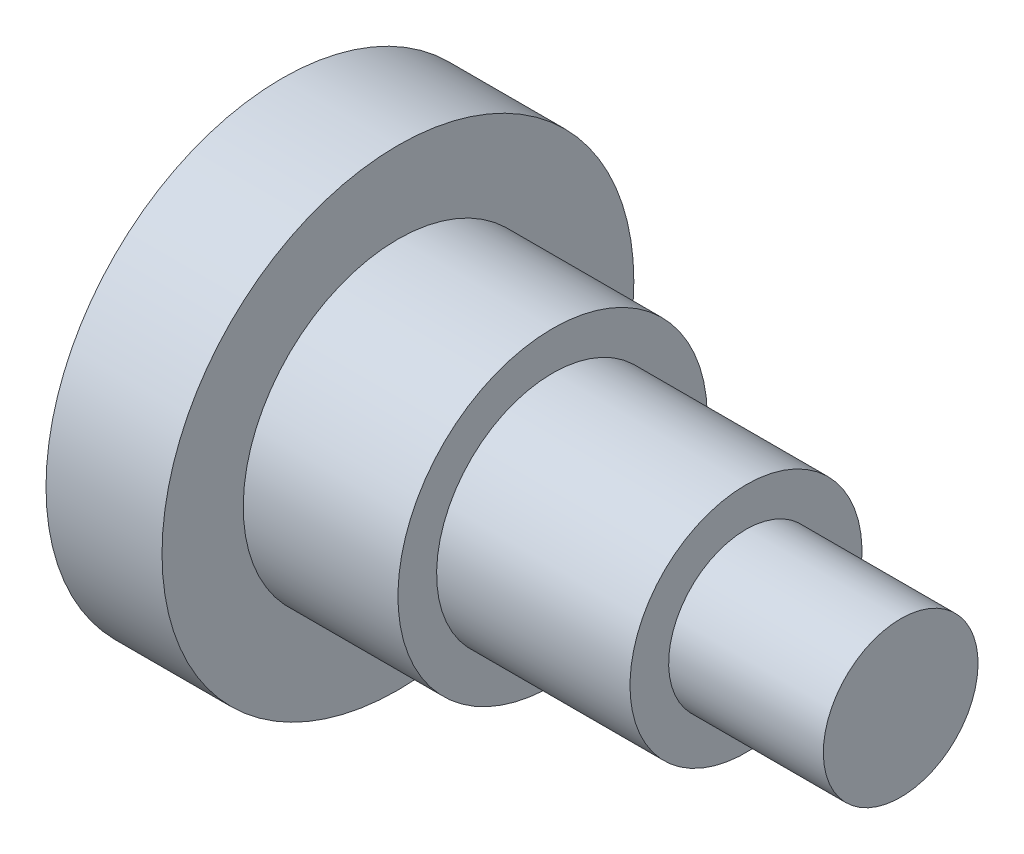
from build123d import *

# Parameters (mm, degrees)
SVUOTA1_T = -2


with BuildPart() as part:
    # Schizzo1 → Rivoluzione1 (revolve)
    with BuildSketch(Plane.XY):
        Polygon((0, 0), (0, 30.5), (15, 30.5), (15, 20), (35, 20), (35, 15), (60, 15), (60, 10), (80, 10), (80, 0), align=None)
    revolve(axis=Axis((80, 0, 0), (-1, 0, 0)))

    # Svuota1
    svuota1_openings = [part.faces().sort_by_distance(p)[0] for p in [
        (0, 0, 0),
    ]]
    offset(amount=SVUOTA1_T, openings=svuota1_openings, kind=Kind.INTERSECTION)


solid = part.part
